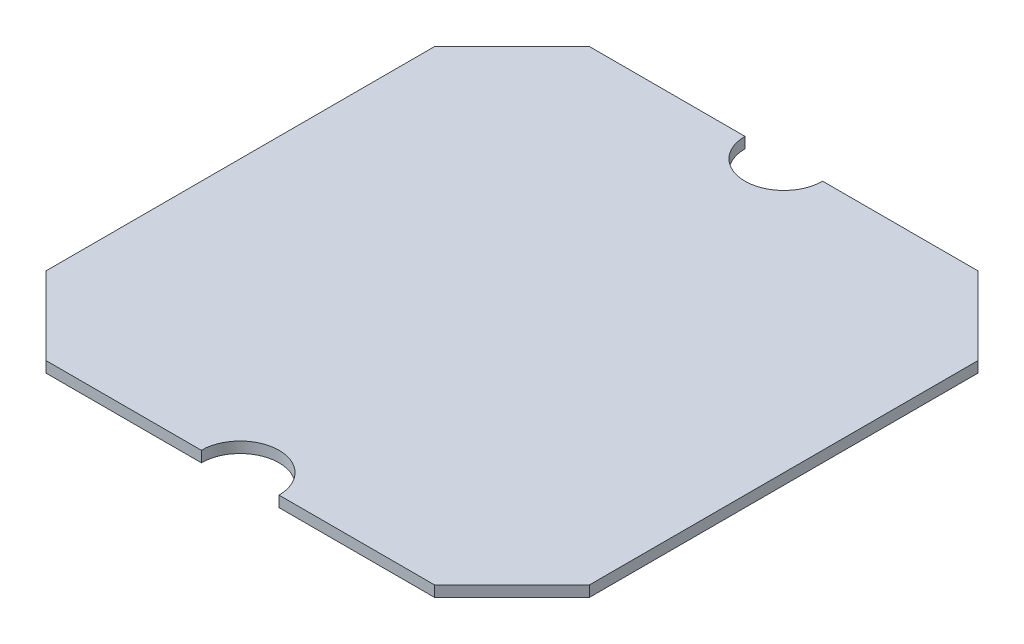
from build123d import *

# Parameters (mm, degrees)
BOSS_EXTRUDE1_DEPTH = 7


with BuildPart() as part:
    # Sketch1 → Boss-Extrude1 (new body)
    with BuildSketch(Plane(origin=(0, 0, 0), x_dir=(1, 0, 0), z_dir=(0, 1, 0))):
        with BuildLine():
            Line((-125, 175), (-25, 175))
            ThreePointArc((-25, 175), (0, 150), (25, 175))
            Line((25, 175), (125, 175))
            Line((125, 175), (175, 125))
            Line((175, 125), (175, -125))
            Line((175, -125), (125, -175))
            Line((125, -175), (25, -175))
            ThreePointArc((25, -175), (0, -150), (-25, -175))
            Line((-25, -175), (-125, -175))
            Line((-125, -175), (-175, -125))
            Line((-175, -125), (-175, 125))
            Line((-175, 125), (-125, 175))
        make_face()
    extrude(amount=BOSS_EXTRUDE1_DEPTH)


solid = part.part
